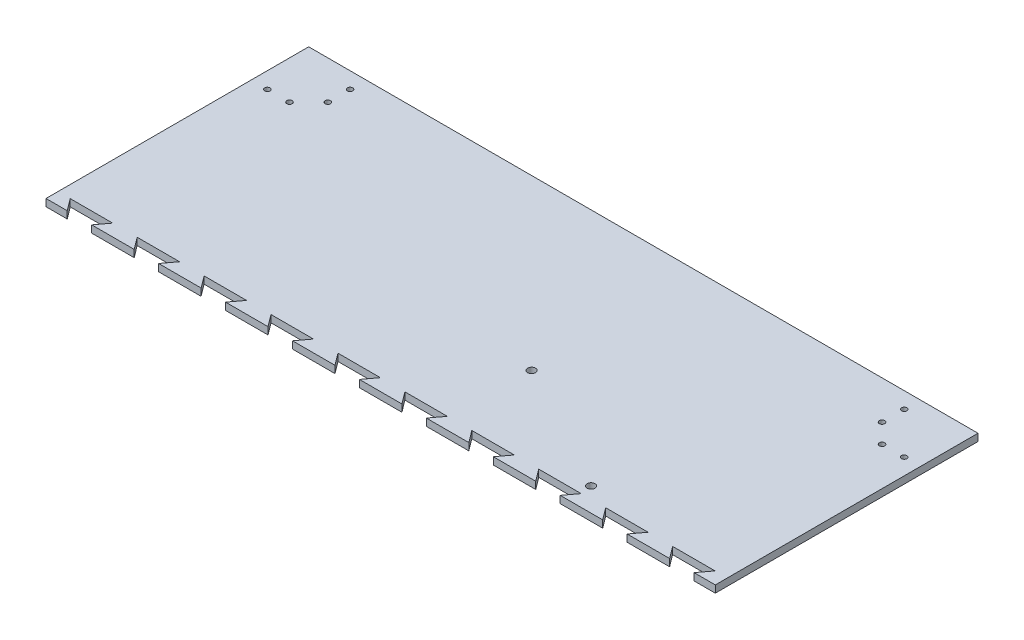
from build123d import *

# Parameters (mm, degrees)
SCHIZZO1_W                   = 558
SCHIZZO1_H                   = 438
ESTRUSIONE_ESTRUSIONE1_DEPTH = 6
SCHIZZO2_R                   = 2.25
TAGLIO_ESTRUSIONE1_DEPTH     = 10
SCHIZZO4_R                   = 3.3
TAGLIO_ESTRUSIONE2_DEPTH     = 10
SCHIZZO5_R                   = 2.25
TAGLIO_ESTRUSIONE3_DEPTH     = 10
TAGLIO_ESTRUSIONE4_DEPTH     = 10


with BuildPart() as part:
    # Schizzo1 → Estrusione-Estrusione1 (new body)
    with BuildSketch(Plane(origin=(0, 0, 0), x_dir=(1, 0, 0), z_dir=(0, 1, 0))):
        Rectangle(SCHIZZO1_W, SCHIZZO1_H)
    extrude(amount=ESTRUSIONE_ESTRUSIONE1_DEPTH)

    # Schizzo2 → Taglio-Estrusione1 (cut)
    with BuildSketch(Plane(origin=(0, 6, 0), x_dir=(1, 0, 0), z_dir=(0, 1, 0))):
        with Locations(Location((-231, 205.5, 0), (0, 0, 270))):
            Circle(SCHIZZO2_R)
        with Locations(Location((-231, 187, 0), (0, 0, 270))):
            Circle(SCHIZZO2_R)
        with Locations(Location((-247, 171, 0), (0, 0, 270))):
            Circle(SCHIZZO2_R)
        with Locations(Location((-265.5, 171, 0), (0, 0, 270))):
            Circle(SCHIZZO2_R)
        with Locations(Location((231, 205.5, 0), (0, 0, 270))):
            Circle(SCHIZZO2_R)
        with Locations(Location((231, 187, 0), (0, 0, 270))):
            Circle(SCHIZZO2_R)
        with Locations(Location((247, 171, 0), (0, 0, 270))):
            Circle(SCHIZZO2_R)
        with Locations(Location((265.5, 171, 0), (0, 0, 270))):
            Circle(SCHIZZO2_R)
        with Locations(Location((265.5, -171, 0), (0, 0, 270))):
            Circle(SCHIZZO2_R)
        with Locations(Location((247, -171, 0), (0, 0, 270))):
            Circle(SCHIZZO2_R)
        with Locations(Location((231, -187, 0), (0, 0, 270))):
            Circle(SCHIZZO2_R)
        with Locations(Location((231, -205.5, 0), (0, 0, 270))):
            Circle(SCHIZZO2_R)
        with Locations(Location((-231, -205.5, 0), (0, 0, 270))):
            Circle(SCHIZZO2_R)
        with Locations(Location((-231, -187, 0), (0, 0, 270))):
            Circle(SCHIZZO2_R)
        with Locations(Location((-247, -171, 0), (0, 0, 270))):
            Circle(SCHIZZO2_R)
        with Locations(Location((-265.5, -171, 0), (0, 0, 270))):
            Circle(SCHIZZO2_R)
    extrude(amount=-TAGLIO_ESTRUSIONE1_DEPTH, mode=Mode.SUBTRACT)

    # Schizzo4 → Taglio-Estrusione2 (cut)
    with BuildSketch(Plane(origin=(0, 6, 0), x_dir=(1, 0, 0), z_dir=(0, 1, 0))):
        with Locations(Location((-11.04713937, -29.950902322, 0), (0, 0, 270))):
            Circle(SCHIZZO4_R)
        with Locations(Location((97.170402481, -88.545989873, 0), (0, 0, 270))):
            Circle(SCHIZZO4_R)
        with Locations(Location((155.765489817, 19.671552094, 0), (0, 0, 270))):
            Circle(SCHIZZO4_R)
        with Locations(Location((47.547947967, 78.266639645, 0), (0, 0, 270))):
            Circle(SCHIZZO4_R)
    extrude(amount=-TAGLIO_ESTRUSIONE2_DEPTH, mode=Mode.SUBTRACT)

    # Schizzo5 → Taglio-Estrusione3 (cut)
    with BuildSketch(Plane.XZ):
        with Locations(Location((-136.921607377, 165.135242981, 0), (0, 0, 270))):
            Circle(SCHIZZO5_R)
        with Locations(Location((-136.921607377, 145.135242981, 0), (0, 0, 270))):
            Circle(SCHIZZO5_R)
    extrude(amount=-TAGLIO_ESTRUSIONE3_DEPTH, mode=Mode.SUBTRACT)

    # Schizzo6 → Taglio-Estrusione4 (cut)
    with BuildSketch(Plane(origin=(0, 6, 0), x_dir=(1, 0, 0), z_dir=(0, 1, 0))):
        Polygon((-279, 0), (-261.3, 0), (-268.8, 10), (-233.4, 10), (-240.9, 0), (-223.2, 0), (-205.5, 0), (-213, 10), (-177.6, 10), (-185.1, 0), (-167.4, 0), (-149.7, 0), (-157.2, 10), (-121.8, 10), (-129.3, 0), (-111.6, 0), (-93.9, 0), (-101.4, 10), (-66, 10), (-73.5, 0), (-55.8, 0), (-38.1, 0), (-45.6, 10), (-10.2, 10), (-17.7, 0), (0, 0), (17.7, 0), (10.2, 10), (45.6, 10), (38.1, 0), (55.8, 0), (73.5, 0), (66, 10), (101.4, 10), (93.9, 0), (111.6, 0), (129.3, 0), (121.8, 10), (157.2, 10), (149.7, 0), (167.4, 0), (185.1, 0), (177.6, 10), (213, 10), (205.5, 0), (223.2, 0), (240.9, 0), (233.4, 10), (268.8, 10), (261.3, 0), (279, 0), (279, -219), (-279, -219), align=None)
    extrude(amount=-TAGLIO_ESTRUSIONE4_DEPTH, mode=Mode.SUBTRACT)


solid = part.part
